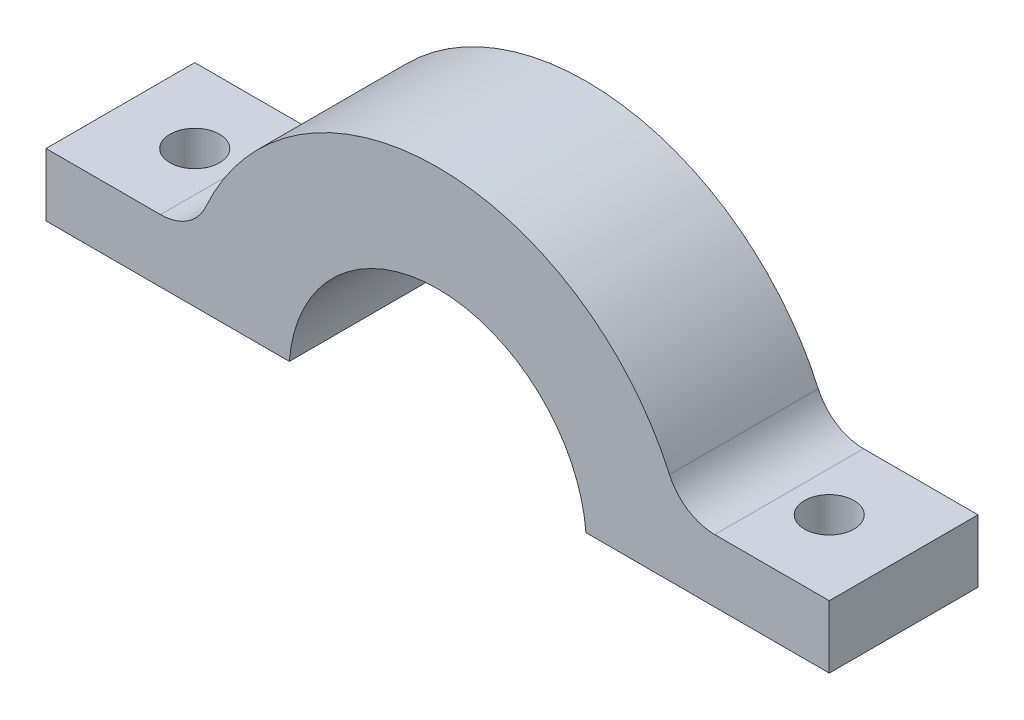
from build123d import *

# Parameters (mm, degrees)
RESSALTO_EXTRUS_O1_DEPTH = 30
ESBO_O2_R                = 5
CORTE_EXTRUS_O1_DEPTH    = 30
FILETE1_R                = 10


with BuildPart() as part:
    # Esboço1 → Ressalto-extrusão1 (new body)
    with BuildSketch(Plane.XY):
        with BuildLine():
            Line((-51.174680709, 2.345199545), (-29.908193511, 2.345199545))
            ThreePointArc((-29.908193511, 2.345199545), (0, 30), (29.908193511, 2.345199545))
            Line((29.908193511, 2.345199545), (51.174680709, 2.345199545))
            Line((51.174680709, 2.345199545), (78.983139003, 2.345199545))
            Line((78.983139003, 2.345199545), (78.983139003, 15))
            Line((78.983139003, 15), (48.983139003, 15))
            ThreePointArc((48.983139003, 15), (0, 51.228389654), (-48.983139003, 15))
            Line((-48.983139003, 15), (-78.983139003, 15))
            Line((-78.983139003, 15), (-78.983139003, 2.345199545))
            Line((-78.983139003, 2.345199545), (-51.174680709, 2.345199545))
        make_face()
    extrude(amount=RESSALTO_EXTRUS_O1_DEPTH)

    # Esboço2 → Corte-extrusão1 (cut)
    with BuildSketch(Plane(origin=(0, 15, 0), x_dir=(1, 0, 0), z_dir=(0, 1, 0))):
        with Locations(Location((-63.983139003, -15, 0), (0, 0, 180))):
            Circle(ESBO_O2_R)
        with Locations(Location((63.983139003, -15, 0), (0, 0, 180))):
            Circle(ESBO_O2_R)
    extrude(amount=-CORTE_EXTRUS_O1_DEPTH, mode=Mode.SUBTRACT)

    # Filete1
    filete1_edges = [part.edges().sort_by_distance(p)[0] for p in [
        (48.983139003, 15, 15),
        (-48.983139003, 15, 15),
    ]]
    fillet(filete1_edges, radius=FILETE1_R)


solid = part.part
